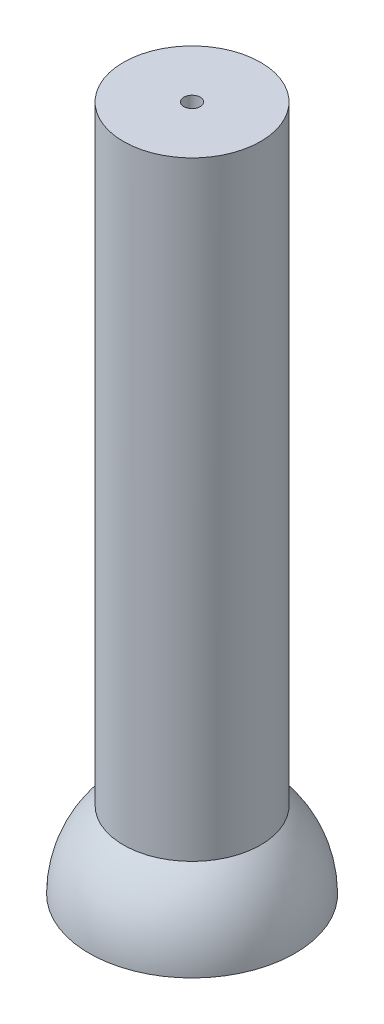
from build123d import *

# Parameters (mm, degrees)
CIRCULAR_BASE_ANGLE       = 180
CIYLINDRICAL_SUPPORT_R    = 5
CYLINDRICAL_SUPPORT_DEPTH = 50
SKETCH5_R                 = 0.6
PILOT_HOLE_DEPTH          = 5
SKETCH6_R                 = 0.895
BOTTOM_HOLE_DEPTH         = 33


with BuildPart() as part:
    # Sketch3 → Circular Base (revolve)
    with BuildSketch(Plane(origin=(0, 0, 0), x_dir=(1, 0, 0), z_dir=(0, 1, 0))):
        with BuildLine():
            Line((-7.5, 0), (7.5, 0))
            ThreePointArc((7.5, 0), (0, -7.5), (-7.5, 0))
        make_face()
    revolve(axis=Axis((-7.5, 0, 0), (-1, 0, 0)), revolution_arc=CIRCULAR_BASE_ANGLE)

    # Ciylindrical Support → Cylindrical Support (add)
    with BuildSketch(Plane(origin=(0, 0, 0), x_dir=(1, 0, 0), z_dir=(0, 1, 0))):
        with Locations(Location((0, 0, 0), (0, 0, 90))):
            Circle(CIYLINDRICAL_SUPPORT_R)
    extrude(amount=CYLINDRICAL_SUPPORT_DEPTH)

    # Sketch5 → Pilot Hole (cut)
    with BuildSketch(Plane(origin=(0, 50, 0), x_dir=(1, 0, 0), z_dir=(0, 1, 0))):
        with Locations(Location((0, 0, 0), (0, 0, 270))):
            Circle(SKETCH5_R)
    extrude(amount=-PILOT_HOLE_DEPTH, mode=Mode.SUBTRACT)

    # Sketch6 → Bottom Hole (cut)
    with BuildSketch(Plane.XZ):
        with Locations(Location((0, 0, 0), (0, 0, 270))):
            Circle(SKETCH6_R)
    extrude(amount=-BOTTOM_HOLE_DEPTH, mode=Mode.SUBTRACT)


solid = part.part
